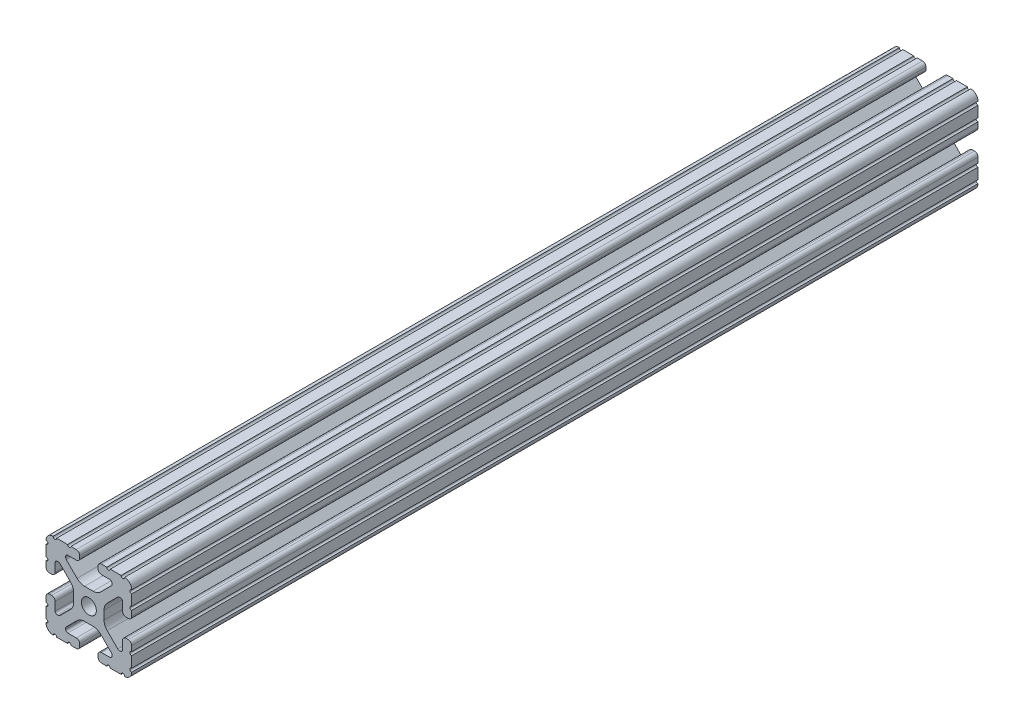
from build123d import *

# Parameters (mm, degrees)
SKETCH1_R      = 3.3274
EXTRUDE1_DEPTH = 376.2


with BuildPart() as part:
    # Sketch1 → Extrude1 (new body)
    with BuildSketch(Plane.XY):
        with BuildLine():
            Line((-10.022898969, 12.91475973), (-5.252158105, 8.144007132))
            ThreePointArc((-5.252158105, 8.144007132), (-3.715177372, 7.117027388), (-1.902183975, 6.7564))
            Line((-1.902183975, 6.7564), (1.902183975, 6.7564))
            ThreePointArc((1.902183975, 6.7564), (3.715177372, 7.117027388), (5.252158105, 8.144007132))
            Line((5.252158105, 8.144007132), (10.022898969, 12.91475973))
            ThreePointArc((10.022898969, 12.91475973), (10.218362387, 13.207291992), (10.287, 13.552357131))
            Line((10.287, 13.552357131), (10.287, 14.0843))
            ThreePointArc((10.287, 14.0843), (10.022898185, 14.721898185), (9.3853, 14.986))
            Line((9.3853, 14.986), (5.617617549, 14.986))
            ThreePointArc((5.617617549, 14.986), (4.519044045, 15.441044045), (4.064, 16.539617549))
            Line((4.064, 16.539617549), (4.064, 17.496382451))
            ThreePointArc((4.064, 17.496382451), (4.519044045, 18.594955955), (5.617617549, 19.05))
            Line((5.617617549, 19.05), (7.974178704, 19.05))
            ThreePointArc((7.974178704, 19.05), (8.736178704, 18.288), (9.498178704, 19.05))
            Line((9.498178704, 19.05), (14.327719207, 19.05))
            ThreePointArc((14.327719207, 19.05), (15.087603123, 18.231251131), (15.847487039, 19.05))
            ThreePointArc((15.847487039, 19.05), (18.120176289, 18.120192083), (19.05, 15.847509295))
            ThreePointArc((19.05, 15.847509295), (18.231250992, 15.08762539), (19.05, 14.327741484))
            Line((19.05, 14.327741484), (19.05, 9.496091471))
            ThreePointArc((19.05, 9.496091471), (18.231250992, 8.736207565), (19.05, 7.97632366))
            Line((19.05, 7.97632366), (19.05, 5.617617549))
            ThreePointArc((19.05, 5.617617549), (18.594955955, 4.519044045), (17.496382451, 4.064))
            Line((17.496382451, 4.064), (16.539617549, 4.064))
            ThreePointArc((16.539617549, 4.064), (15.441044045, 4.519044045), (14.986, 5.617617549))
            Line((14.986, 5.617617549), (14.986, 9.385342516))
            ThreePointArc((14.986, 9.385342516), (14.721898185, 10.022940701), (14.0843, 10.287042516))
            Line((14.0843, 10.287042516), (13.516042086, 10.287042516))
            ThreePointArc((13.516042086, 10.287042516), (13.170975923, 10.218404478), (12.878443117, 10.022939917))
            Line((12.878443117, 10.022939917), (8.14758008, 5.292065243))
            ThreePointArc((8.14758008, 5.292065243), (7.117955879, 3.751120653), (6.7564, 1.933453584))
            Line((6.7564, 1.933453584), (6.7564, -1.933453584))
            ThreePointArc((6.7564, -1.933453584), (7.117955879, -3.751120653), (8.14758008, -5.292065243))
            Line((8.14758008, -5.292065243), (12.878443117, -10.022939917))
            ThreePointArc((12.878443117, -10.022939917), (13.170975923, -10.218404478), (13.516042086, -10.287042516))
            Line((13.516042086, -10.287042516), (14.0843, -10.287042516))
            ThreePointArc((14.0843, -10.287042516), (14.721898185, -10.022940701), (14.986, -9.385342516))
            Line((14.986, -9.385342516), (14.986, -5.617617549))
            ThreePointArc((14.986, -5.617617549), (15.441044045, -4.519044045), (16.539617549, -4.064))
            Line((16.539617549, -4.064), (17.496382451, -4.064))
            ThreePointArc((17.496382451, -4.064), (18.594955955, -4.519044045), (19.05, -5.617617549))
            Line((19.05, -5.617617549), (19.05, -7.976318491))
            ThreePointArc((19.05, -7.976318491), (18.231250992, -8.736202396), (19.05, -9.496086302))
            Line((19.05, -9.496086302), (19.05, -14.32774291))
            ThreePointArc((19.05, -14.32774291), (18.231250992, -15.087626816), (19.05, -15.847510721))
            ThreePointArc((19.05, -15.847510721), (18.120175716, -18.120192644), (15.847486868, -19.05))
            ThreePointArc((15.847486868, -19.05), (15.087602952, -18.231251131), (14.327719036, -19.05))
            Line((14.327719036, -19.05), (9.496062448, -19.05))
            ThreePointArc((9.496062448, -19.05), (8.736178532, -18.231251131), (7.976294616, -19.05))
            Line((7.976294616, -19.05), (5.617617549, -19.05))
            ThreePointArc((5.617617549, -19.05), (4.519044045, -18.594955955), (4.064, -17.496382451))
            Line((4.064, -17.496382451), (4.064, -16.539617549))
            ThreePointArc((4.064, -16.539617549), (4.519044045, -15.441044045), (5.617617549, -14.986))
            Line((5.617617549, -14.986), (9.3853, -14.986))
            ThreePointArc((9.3853, -14.986), (10.022898185, -14.721898185), (10.287, -14.0843))
            Line((10.287, -14.0843), (10.287, -13.552357131))
            ThreePointArc((10.287, -13.552357131), (10.218362387, -13.207291992), (10.022898969, -12.91475973))
            Line((10.022898969, -12.91475973), (5.252158105, -8.144007132))
            ThreePointArc((5.252158105, -8.144007132), (3.715177372, -7.117027388), (1.902183975, -6.7564))
            Line((1.902183975, -6.7564), (-1.902183975, -6.7564))
            ThreePointArc((-1.902183975, -6.7564), (-3.715177372, -7.117027388), (-5.252158105, -8.144007132))
            Line((-5.252158105, -8.144007132), (-10.022898969, -12.91475973))
            ThreePointArc((-10.022898969, -12.91475973), (-10.218362387, -13.207291992), (-10.287, -13.552357131))
            Line((-10.287, -13.552357131), (-10.287, -14.0843))
            ThreePointArc((-10.287, -14.0843), (-10.022898185, -14.721898185), (-9.3853, -14.986))
            Line((-9.3853, -14.986), (-5.617617549, -14.986))
            ThreePointArc((-5.617617549, -14.986), (-4.519044045, -15.441044045), (-4.064, -16.539617549))
            Line((-4.064, -16.539617549), (-4.064, -17.496382451))
            ThreePointArc((-4.064, -17.496382451), (-4.519044045, -18.594955955), (-5.617617549, -19.05))
            Line((-5.617617549, -19.05), (-7.976294616, -19.05))
            ThreePointArc((-7.976294616, -19.05), (-8.736178532, -18.231251131), (-9.496062448, -19.05))
            Line((-9.496062448, -19.05), (-14.327719036, -19.05))
            ThreePointArc((-14.327719036, -19.05), (-15.087602952, -18.231251131), (-15.847486868, -19.05))
            ThreePointArc((-15.847486868, -19.05), (-18.120175716, -18.120192644), (-19.05, -15.847510721))
            ThreePointArc((-19.05, -15.847510721), (-18.231250992, -15.087626816), (-19.05, -14.32774291))
            Line((-19.05, -14.32774291), (-19.05, -9.496086302))
            ThreePointArc((-19.05, -9.496086302), (-18.231250992, -8.736202396), (-19.05, -7.976318491))
            Line((-19.05, -7.976318491), (-19.05, -5.617617549))
            ThreePointArc((-19.05, -5.617617549), (-18.594955955, -4.519044045), (-17.496382451, -4.064))
            Line((-17.496382451, -4.064), (-16.539617549, -4.064))
            ThreePointArc((-16.539617549, -4.064), (-15.441044045, -4.519044045), (-14.986, -5.617617549))
            Line((-14.986, -5.617617549), (-14.986, -9.385342516))
            ThreePointArc((-14.986, -9.385342516), (-14.721898185, -10.022940701), (-14.0843, -10.287042516))
            Line((-14.0843, -10.287042516), (-13.516042086, -10.287042516))
            ThreePointArc((-13.516042086, -10.287042516), (-13.170975923, -10.218404478), (-12.878443117, -10.022939917))
            Line((-12.878443117, -10.022939917), (-8.14758008, -5.292065243))
            ThreePointArc((-8.14758008, -5.292065243), (-7.117955879, -3.751120653), (-6.7564, -1.933453584))
            Line((-6.7564, -1.933453584), (-6.7564, 1.933453584))
            ThreePointArc((-6.7564, 1.933453584), (-7.117955879, 3.751120653), (-8.14758008, 5.292065243))
            Line((-8.14758008, 5.292065243), (-12.878443117, 10.022939917))
            ThreePointArc((-12.878443117, 10.022939917), (-13.170975923, 10.218404478), (-13.516042086, 10.287042516))
            Line((-13.516042086, 10.287042516), (-14.0843, 10.287042516))
            ThreePointArc((-14.0843, 10.287042516), (-14.721898185, 10.022940701), (-14.986, 9.385342516))
            Line((-14.986, 9.385342516), (-14.986, 5.617617549))
            ThreePointArc((-14.986, 5.617617549), (-15.441044045, 4.519044045), (-16.539617549, 4.064))
            Line((-16.539617549, 4.064), (-17.496382451, 4.064))
            ThreePointArc((-17.496382451, 4.064), (-18.594955955, 4.519044045), (-19.05, 5.617617549))
            Line((-19.05, 5.617617549), (-19.05, 7.97632366))
            ThreePointArc((-19.05, 7.97632366), (-18.231250992, 8.736207565), (-19.05, 9.496091471))
            Line((-19.05, 9.496091471), (-19.05, 14.327741484))
            ThreePointArc((-19.05, 14.327741484), (-18.231250992, 15.08762539), (-19.05, 15.847509295))
            ThreePointArc((-19.05, 15.847509295), (-18.120176289, 18.120192083), (-15.847487039, 19.05))
            ThreePointArc((-15.847487039, 19.05), (-15.087603123, 18.231251131), (-14.327719207, 19.05))
            Line((-14.327719207, 19.05), (-9.498178704, 19.05))
            ThreePointArc((-9.498178704, 19.05), (-8.736178704, 18.288), (-7.974178704, 19.05))
            Line((-7.974178704, 19.05), (-5.617617549, 19.05))
            ThreePointArc((-5.617617549, 19.05), (-4.519044045, 18.594955955), (-4.064, 17.496382451))
            Line((-4.064, 17.496382451), (-4.064, 16.539617549))
            ThreePointArc((-4.064, 16.539617549), (-4.519044045, 15.441044045), (-5.617617549, 14.986))
            Line((-5.617617549, 14.986), (-9.3853, 14.986))
            ThreePointArc((-9.3853, 14.986), (-10.022898185, 14.721898185), (-10.287, 14.0843))
            Line((-10.287, 14.0843), (-10.287, 13.552357131))
            ThreePointArc((-10.287, 13.552357131), (-10.218362387, 13.207291992), (-10.022898969, 12.91475973))
        make_face()
        Circle(SKETCH1_R, mode=Mode.SUBTRACT)
    extrude(amount=-EXTRUDE1_DEPTH)


solid = part.part
